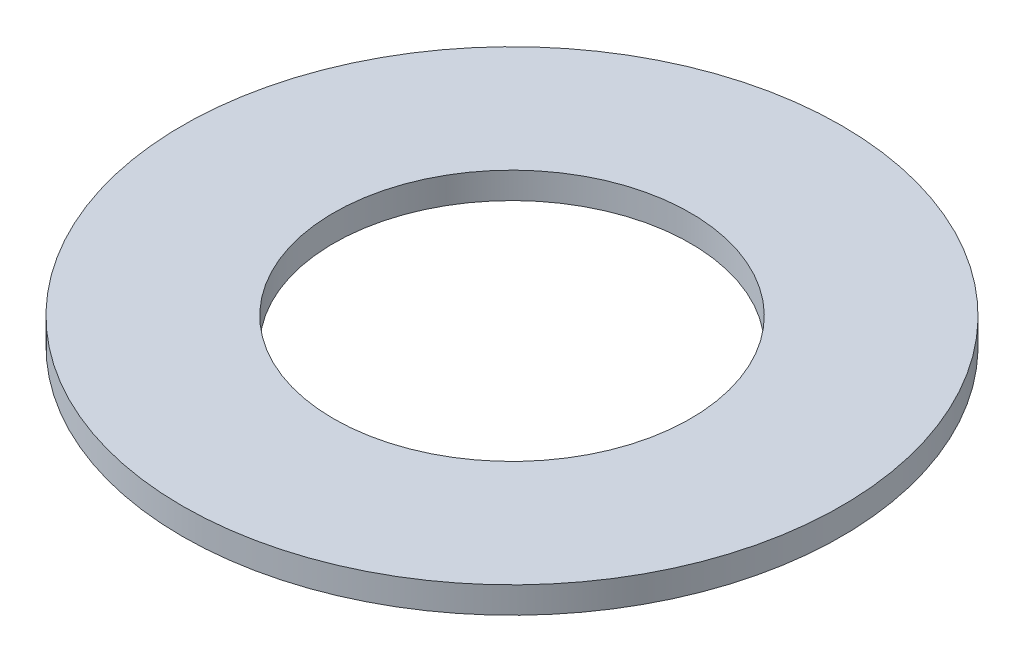
from build123d import *

# Parameters (mm, degrees)
SKETCH1_R           = 19.05
BOSS_EXTRUDE1_DEPTH = 1.524
SKETCH5_R           = 10.3124
CUT_EXTRUDE1_DEPTH  = 27.983839163


with BuildPart() as part:
    # Sketch1 → Boss-Extrude1 (new body)
    with BuildSketch(Plane(origin=(0, 0, 0), x_dir=(1, 0, 0), z_dir=(0, 1, 0))):
        with Locations(Location((0, 0, 0), (0, 0, 90))):
            Circle(SKETCH1_R)
    extrude(amount=BOSS_EXTRUDE1_DEPTH)

    # Sketch5 → Cut-Extrude1 (cut, through all)
    with BuildSketch(Plane(origin=(0, 1.524, 0), x_dir=(-1, 0, 0), z_dir=(0, 1, 0))):
        with Locations(Location((0, 0, 0), (0, 0, 90))):
            Circle(SKETCH5_R)
    extrude(amount=-CUT_EXTRUDE1_DEPTH, mode=Mode.SUBTRACT)


solid = part.part
